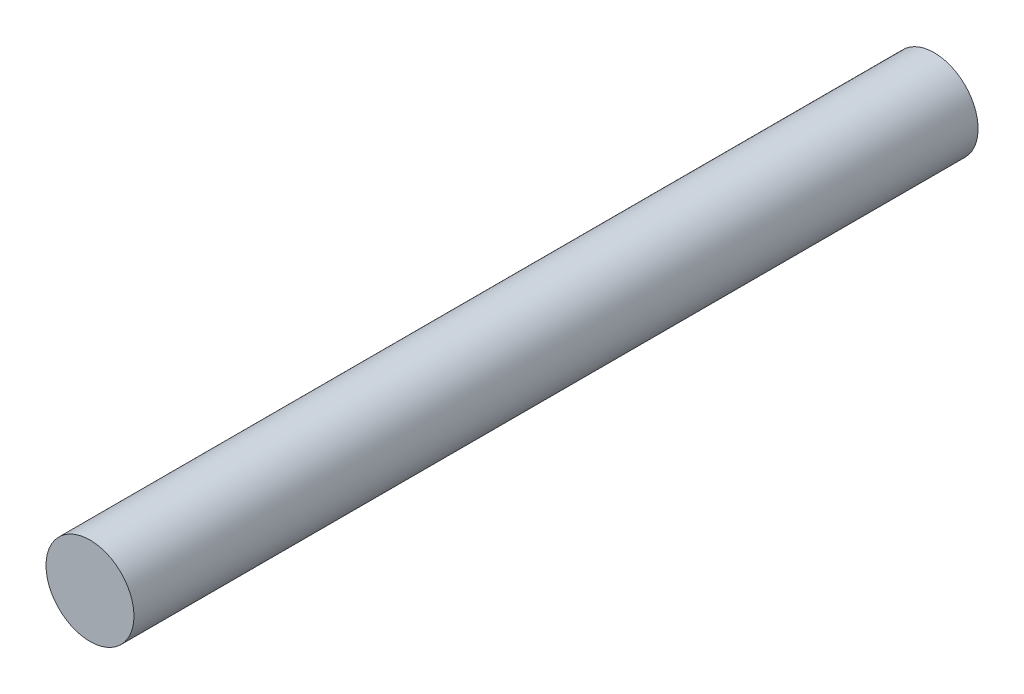
from build123d import *

# Parameters (mm, degrees)
SKETCH1_R           = 3.175
BOSS_EXTRUDE1_DEPTH = 60.96


with BuildPart() as part:
    # Sketch1 → Boss-Extrude1 (new body)
    with BuildSketch(Plane.XY):
        with Locations(Location((0, 0, 0), (0, 0, 180))):
            Circle(SKETCH1_R)
    extrude(amount=BOSS_EXTRUDE1_DEPTH)


solid = part.part
